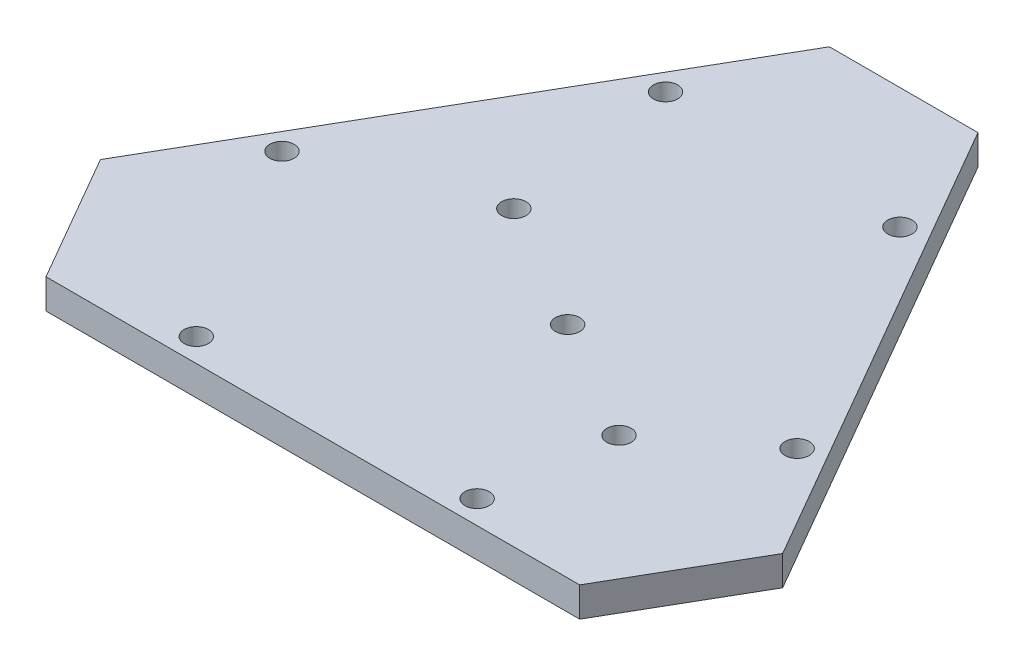
from build123d import *

# Parameters (mm, degrees)
BOSS_EXTRUDE1_DEPTH = 6.35
SKETCH9_R           = 2.6
CUT_EXTRUDE1_DEPTH  = 105.776848123
SKETCH12_R          = 2.6
CUT_EXTRUDE4_DEPTH  = 105.776848123


with BuildPart() as part:
    # Sketch1 → Boss-Extrude1 (new body)
    with BuildSketch(Plane(origin=(0, 0, 0), x_dir=(1, 0, 0), z_dir=(0, 1, 0))):
        Polygon((-15.875, 75), (15.875, 75), (72.889405284, -23.751846715), (57.014405284, -51.248153285), (-57.014405284, -51.248153285), (-72.889405284, -23.751846715), align=None)
    extrude(amount=BOSS_EXTRUDE1_DEPTH)

    # Sketch9 → Cut-Extrude1 (cut, through all)
    with BuildSketch(Plane(origin=(0, 6.35, 0), x_dir=(1, 0, 0), z_dir=(0, 1, 0))):
        with Locations(Location((-25.030312278, 49.142819263, 0), (0, 0, 270))):
            Circle(SKETCH9_R)
        with Locations(Location((25.008570083, 49.180192562, 0), (0, 0, 270))):
            Circle(SKETCH9_R)
        with Locations(Location((55.008731986, -2.78123819, 0), (0, 0, 270))):
            Circle(SKETCH9_R)
        with Locations(Location((30.09884337, -46.248153285, 0), (0, 0, 270))):
            Circle(SKETCH9_R)
        with Locations(Location((-55.030188745, -2.818776286, 0), (0, 0, 270))):
            Circle(SKETCH9_R)
        with Locations(Location((-29.90115663, -46.248153285, 0), (0, 0, 270))):
            Circle(SKETCH9_R)
    extrude(amount=-CUT_EXTRUDE1_DEPTH, mode=Mode.SUBTRACT)

    # Sketch12 → Cut-Extrude4 (cut, through all)
    with BuildSketch(Plane(origin=(0, 6.35, 0), x_dir=(1, 0, 0), z_dir=(0, 1, 0))):
        with Locations(Location((33.539251883, -19.363896103, 0), (0, 0, 270))):
            Circle(SKETCH12_R)
        with Locations(Location((7.55848977, -4.363896103, 0), (0, 0, 270))):
            Circle(SKETCH12_R)
        with Locations(Location((-19.638606793, 11.338354919, 0), (0, 0, 270))):
            Circle(SKETCH12_R)
    extrude(amount=-CUT_EXTRUDE4_DEPTH, mode=Mode.SUBTRACT)


solid = part.part
